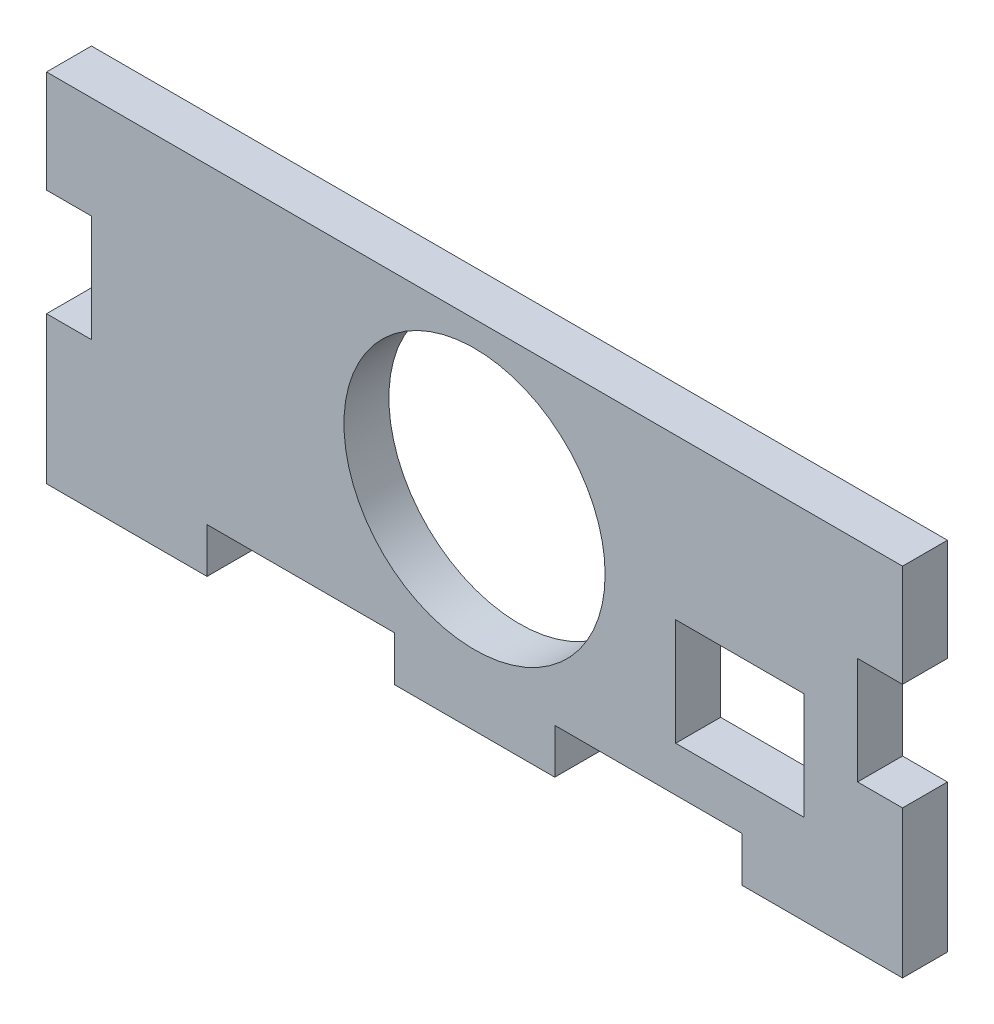
from build123d import *

# Parameters (mm, degrees)
SKETCH1_W           = 101.6
SKETCH1_H           = 37
BOSS_EXTRUDE1_DEPTH = 5.334
SKETCH2_R           = 15.5
MOTOR_HOLE_DEPTH    = 55.326251076
SKETCH4_W           = 19.05
SKETCH4_H           = 5.334
BOTTOM_TABS_DEPTH   = 5.334
SKETCH5_W           = 5.334
SKETCH5_H           = 12.7
CUT_EXTRUDE1_DEPTH  = 57.366223148
SKETCH6_W           = 15.24
SKETCH6_H           = 12.7
CUT_EXTRUDE2_DEPTH  = 77.262693919


with BuildPart() as part:
    # Sketch1 → Boss-Extrude1 (new body)
    with BuildSketch(Plane.XY):
        Rectangle(SKETCH1_W, SKETCH1_H)
    extrude(amount=-BOSS_EXTRUDE1_DEPTH)

    # Sketch2 → Motor Hole (cut, through all)
    with BuildSketch(Plane.XY):
        Circle(SKETCH2_R)
    extrude(amount=-MOTOR_HOLE_DEPTH, mode=Mode.SUBTRACT)

    # Sketch4 → Bottom Tabs (add)
    with BuildSketch(Plane.XZ.offset(18.5)):
        with Locations((-41.275, -2.667)):
            Rectangle(SKETCH4_W, SKETCH4_H)
        with Locations((0, -2.667)):
            Rectangle(SKETCH4_W, SKETCH4_H)
        with Locations((41.275, -2.667)):
            Rectangle(SKETCH4_W, SKETCH4_H)
    extrude(amount=BOTTOM_TABS_DEPTH)

    # Sketch5 → Cut-Extrude1 (cut, through all)
    with BuildSketch(Plane.XY):
        with Locations((-48.133, 0)):
            Rectangle(SKETCH5_W, SKETCH5_H)
        with Locations((48.133, 0)):
            Rectangle(SKETCH5_W, SKETCH5_H)
    extrude(amount=-CUT_EXTRUDE1_DEPTH, mode=Mode.SUBTRACT)

    # Sketch6 → Cut-Extrude2 (cut, through all)
    with BuildSketch(Plane(origin=(16.243120564, -7.106483242, 20.4638), x_dir=(1, 0, 0), z_dir=(0, 0, 1))):
        with Locations((15.252879436, 0.290483242)):
            Rectangle(SKETCH6_W, SKETCH6_H)
    extrude(amount=-CUT_EXTRUDE2_DEPTH, mode=Mode.SUBTRACT)


solid = part.part
